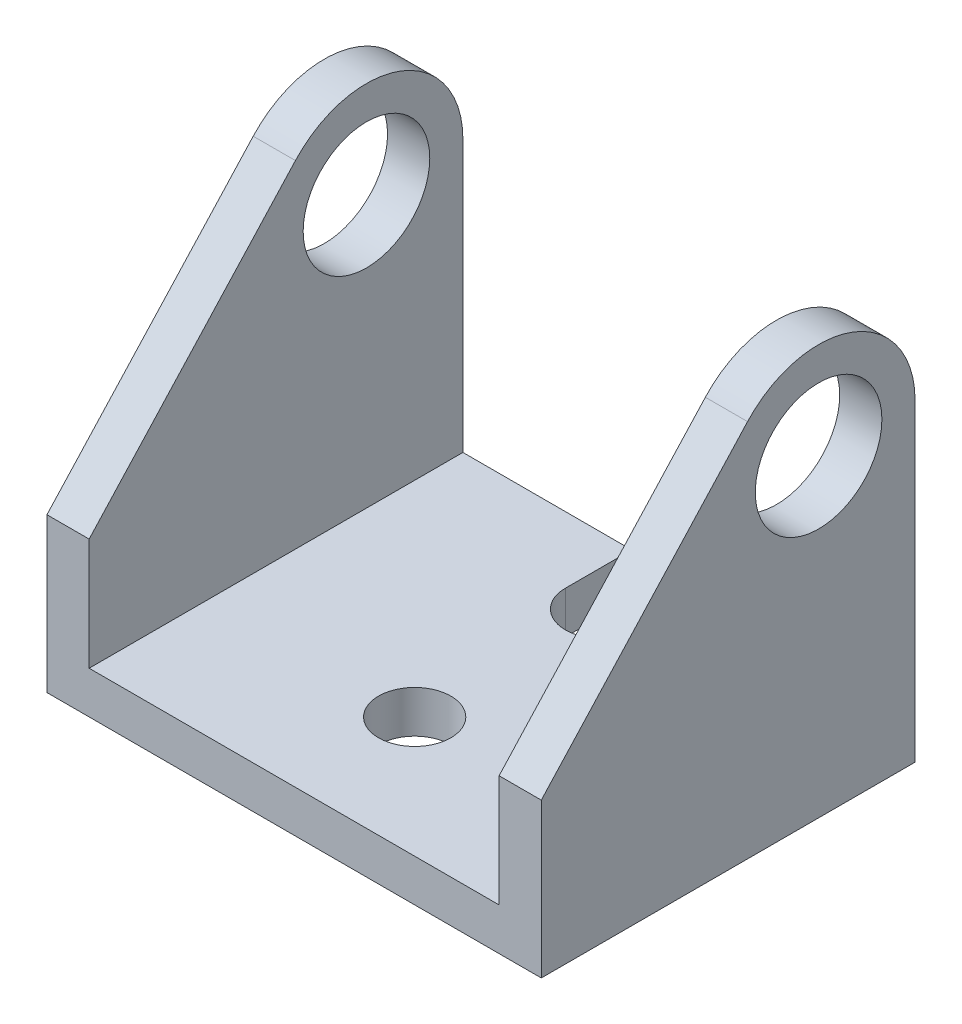
from build123d import *

# Parameters (mm, degrees)
SKETCH_1_W          = 41
SKETCH_1_H          = 31
EXTRUDE_1_DEPTH     = 3.5
SKETCH_2_W          = 3.5
SKETCH_2_H          = 31
EXTRUDE_2_DEPTH     = 40
SKETCH_3_R          = 5.25
CUT_EXTRUDE_2_DEPTH = 62.753542409
SKETCH_4_R          = 3
CUT_EXTRUDE_3_DEPTH = 40


with BuildPart() as part:
    # 草图1 → 凸台-拉伸1 (new body)
    with BuildSketch(Plane(origin=(0, 0, 0), x_dir=(1, 0, 0), z_dir=(0, 1, 0))):
        Rectangle(SKETCH_1_W, SKETCH_1_H)
    extrude(amount=EXTRUDE_1_DEPTH)

    # 草图2 → 凸台-拉伸2 (add)
    with BuildSketch(Plane(origin=(0, 3.5, 0), x_dir=(1, 0, 0), z_dir=(0, 1, 0))):
        with Locations((-18.75, 0)):
            Rectangle(SKETCH_2_W, SKETCH_2_H)
        with Locations((18.75, 0)):
            Rectangle(SKETCH_2_W, SKETCH_2_H)
    extrude(amount=EXTRUDE_2_DEPTH)

    # 草图3 → 切除-拉伸2 (cut, through all)
    with BuildSketch(Plane(origin=(20.5, 0, 0), x_dir=(0, 0, -1), z_dir=(1, 0, 0))):
        with Locations((7.5, 26)):
            Circle(SKETCH_3_R)
        with BuildLine():
            Line((1.60695917, 31.41036688), (-15.5, 12.77724807))
            Line((-15.5, 12.77724807), (-15.5, 43.5))
            Line((-15.5, 43.5), (15.5, 43.5))
            Line((15.5, 43.5), (15.5, 26))
            ThreePointArc((15.5, 26), (10.403073661, 33.454673925), (1.60695917, 31.41036688))
        make_face()
    extrude(amount=-CUT_EXTRUDE_2_DEPTH, mode=Mode.SUBTRACT)

    # 草图4 → 切除-拉伸3 (cut)
    with BuildSketch(Plane(origin=(0, 3.5, 0), x_dir=(1, 0, 0), z_dir=(0, 1, 0))):
        with Locations(Location((0, -5.5, 0), (0, 0, 270))):
            Circle(SKETCH_4_R)
        with BuildLine():
            Line((-3, 10), (-3, 15.5))
            Line((-3, 15.5), (3, 15.5))
            Line((3, 15.5), (3, 10))
            ThreePointArc((3, 10), (0, 7), (-3, 10))
        make_face()
    extrude(amount=-CUT_EXTRUDE_3_DEPTH, mode=Mode.SUBTRACT)


solid = part.part
